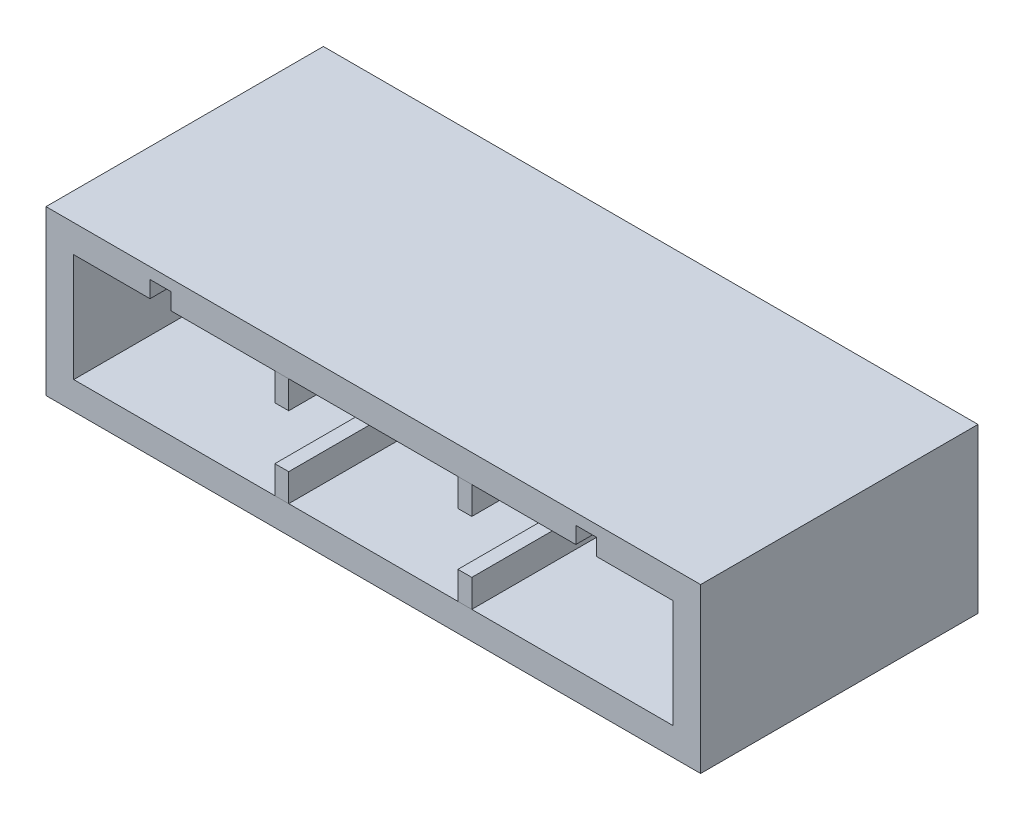
from build123d import *

# Parameters (mm, degrees)
CROQUIS1_W                = 47.2
CROQUIS1_H                = 11.8
CROQUIS1_W_2              = 43.2
CROQUIS1_H_2              = 7.8
SALIENTE_EXTRUIR1_DEPTH   = 20
CROQUIS2_W                = 1.5
CROQUIS2_H                = 1.2
CORTAR_EXTRUIR1_DEPTH     = 20
CROQUIS3_W                = 1
CROQUIS3_H                = 2
SALIENTE_EXTRUIR2_DEPTH   = 20
SALIENTE_EXTRUIR2_2_DEPTH = 20
SALIENTE_EXTRUIR2_3_DEPTH = 20
SALIENTE_EXTRUIR2_4_DEPTH = 20


with BuildPart() as part:
    # Croquis1 → Saliente-Extruir1 (new body)
    with BuildSketch(Plane.XY):
        with Locations((0, -8.96031539)):
            Rectangle(CROQUIS1_W, CROQUIS1_H)
        with Locations((0, -8.96031539)):
            Rectangle(CROQUIS1_W_2, CROQUIS1_H_2, mode=Mode.SUBTRACT)
    extrude(amount=SALIENTE_EXTRUIR1_DEPTH)

    # Croquis2 → Cortar-Extruir1 (cut)
    with BuildSketch(Plane.XY.offset(20)):
        with Locations((-15.35, -4.46031539)):
            Rectangle(CROQUIS2_W, CROQUIS2_H)
        with Locations((15.35, -4.46031539)):
            Rectangle(CROQUIS2_W, CROQUIS2_H)
    extrude(amount=-CORTAR_EXTRUIR1_DEPTH, mode=Mode.SUBTRACT)


with BuildPart() as body_2:
    # Croquis3 → Saliente-Extruir2 (new body)
    with BuildSketch(Plane.XY.offset(20)):
        with Locations((-6.6, -6.06031539)):
            Rectangle(CROQUIS3_W, CROQUIS3_H)
    extrude(amount=-SALIENTE_EXTRUIR2_DEPTH)


with BuildPart() as body_3:
    # Croquis3 → Saliente-Extruir2 2 (new body)
    with BuildSketch(Plane.XY.offset(20)):
        with Locations((6.6, -6.06031539)):
            Rectangle(CROQUIS3_W, CROQUIS3_H)
    extrude(amount=-SALIENTE_EXTRUIR2_2_DEPTH)


with BuildPart() as body_4:
    # Croquis3 → Saliente-Extruir2 3 (new body)
    with BuildSketch(Plane.XY.offset(20)):
        with Locations((-6.6, -11.86031539)):
            Rectangle(CROQUIS3_W, CROQUIS3_H)
    extrude(amount=-SALIENTE_EXTRUIR2_3_DEPTH)


with BuildPart() as body_5:
    # Croquis3 → Saliente-Extruir2 4 (new body)
    with BuildSketch(Plane.XY.offset(20)):
        with Locations((6.6, -11.86031539)):
            Rectangle(CROQUIS3_W, CROQUIS3_H)
    extrude(amount=-SALIENTE_EXTRUIR2_4_DEPTH)


solid = Compound([part.part, body_2.part, body_3.part, body_4.part, body_5.part])
